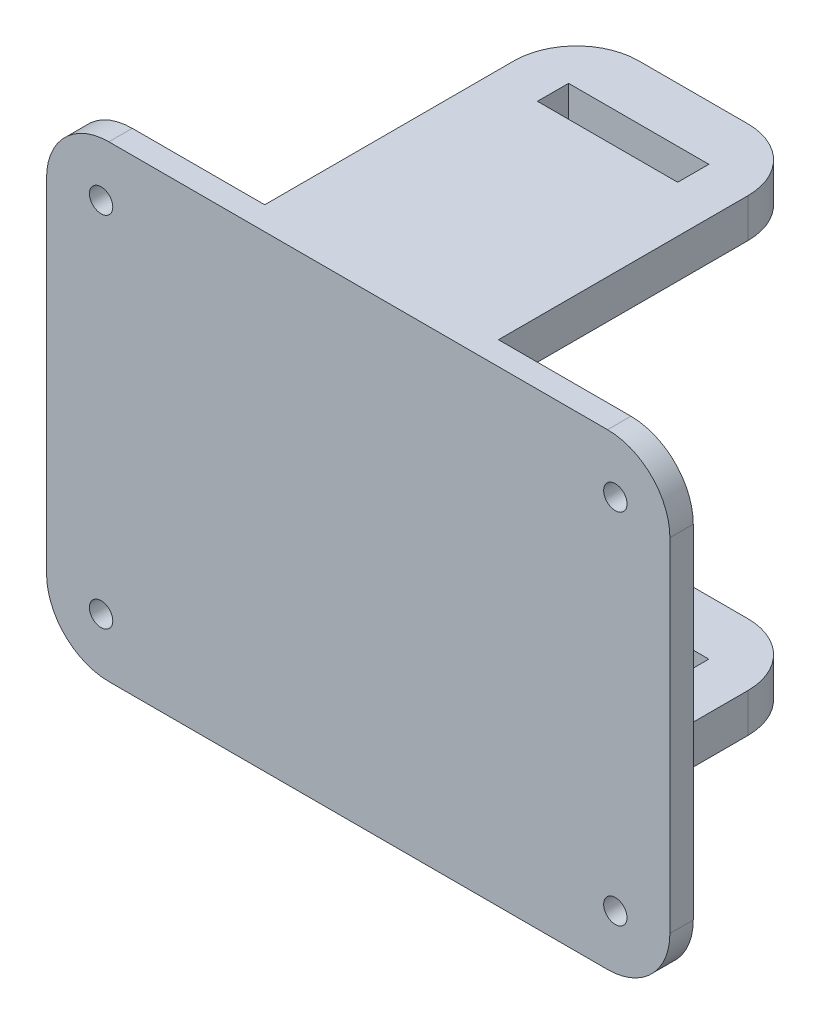
from build123d import *

# Parameters (mm, degrees)
SKETCH1_W           = 30
SKETCH1_H           = 60
BOSS_EXTRUDE1_DEPTH = 5
SKETCH2_W           = 30
SKETCH2_H           = 5
BOSS_EXTRUDE2_DEPTH = 40
BOSS_EXTRUDE3_DEPTH = 7
FILLET1_R           = 2
SKETCH4_W           = 5
SKETCH4_H           = 60
BOSS_EXTRUDE4_DEPTH = 25
SKETCH5_W           = 5
SKETCH5_H           = 60
BOSS_EXTRUDE5_DEPTH = 25
FILLET2_R           = 8
SKETCH6_R           = 1.5
CUT_EXTRUDE1_DEPTH  = 5
FILLET3_R           = 8
CUT_EXTRUDE2_REACH  = 87
SKETCH7_W           = 18
SKETCH7_H           = 4
CUT_EXTRUDE4_DEPTH  = 2


with BuildPart() as part:
    # Sketch1 → Boss-Extrude1 (new body)
    with BuildSketch(Plane.XY):
        Rectangle(SKETCH1_W, SKETCH1_H)
    extrude(amount=-BOSS_EXTRUDE1_DEPTH)

    # Sketch2 → Boss-Extrude2 (add)
    with BuildSketch(Plane(origin=(0, 0, -5), x_dir=(-1, 0, 0), z_dir=(0, 0, -1))):
        with Locations((0, -27.5)):
            Rectangle(SKETCH2_W, SKETCH2_H)
        with Locations((0, 27.5)):
            Rectangle(SKETCH2_W, SKETCH2_H)
    extrude(amount=BOSS_EXTRUDE2_DEPTH)

    # Sketch3 → Boss-Extrude3 (add)
    with BuildSketch(Plane(origin=(0, 0, -5), x_dir=(-1, 0, 0), z_dir=(0, 0, -1))):
        with BuildLine():
            Line((4, -2.5), (-4, -2.5))
            ThreePointArc((-4, -2.5), (-5.414213562, -1.914213562), (-6, -0.5))
            Line((-6, -0.5), (-6, 0.5))
            ThreePointArc((-6, 0.5), (-5.414213562, 1.914213562), (-4, 2.5))
            Line((-4, 2.5), (4, 2.5))
            ThreePointArc((4, 2.5), (5.414213562, 1.914213562), (6, 0.5))
            Line((6, 0.5), (6, -0.5))
            ThreePointArc((6, -0.5), (5.414213562, -1.914213562), (4, -2.5))
        make_face()
    extrude(amount=BOSS_EXTRUDE3_DEPTH)

    # Fillet1
    fillet1_edges = [part.edges().sort_by_distance(p)[0] for p in [
        (0, -25, -5),
        (0, 25, -5),
    ]]
    fillet(fillet1_edges, radius=FILLET1_R)

    # Sketch4 → Boss-Extrude4 (add)
    with BuildSketch(Plane(origin=(15, 0, 0), x_dir=(0, 0, -1), z_dir=(1, 0, 0))):
        with Locations((2.5, 0)):
            Rectangle(SKETCH4_W, SKETCH4_H)
    extrude(amount=BOSS_EXTRUDE4_DEPTH)

    # Sketch5 → Boss-Extrude5 (add)
    with BuildSketch(Plane.ZY.offset(15)):
        with Locations((-2.5, 0)):
            Rectangle(SKETCH5_W, SKETCH5_H)
    extrude(amount=BOSS_EXTRUDE5_DEPTH)

    # Fillet2
    fillet2_edges = [part.edges().sort_by_distance(p)[0] for p in [
        (40, 30, -2.5),
        (40, -30, -2.5),
        (-40, -30, -2.5),
        (-40, 30, -2.5),
    ]]
    fillet(fillet2_edges, radius=FILLET2_R)

    # Sketch6 → Cut-Extrude1 (cut)
    with BuildSketch(Plane(origin=(0, 0, -5), x_dir=(-1, 0, 0), z_dir=(0, 0, -1))):
        with Locations((33, -23)):
            Circle(SKETCH6_R)
        with Locations(Location((-33, -23, 0), (0, 0, 180))):
            Circle(SKETCH6_R)
        with Locations((-33, 23)):
            Circle(SKETCH6_R)
        with Locations(Location((33, 23, 0), (0, 0, 180))):
            Circle(SKETCH6_R)
    extrude(amount=-CUT_EXTRUDE1_DEPTH, mode=Mode.SUBTRACT)

    # Fillet3
    fillet3_edges = [part.edges().sort_by_distance(p)[0] for p in [
        (-15, -27.5, -45),
        (15, -27.5, -45),
        (-15, 27.5, -45),
        (15, 27.5, -45),
    ]]
    fillet(fillet3_edges, radius=FILLET3_R)

    # Cut-Extrude2: up to this face of the body (flat: up to its plane)
    cut_extrude2_end = Plane(part.part.faces().sort_by_distance((0, -30, -19.840780346))[0])
    # Sketch7 → Cut-Extrude2 (cut, up to the picked face)
    with BuildSketch(Plane(origin=(0, 30, 0), x_dir=(1, 0, 0), z_dir=(0, 1, 0)), mode=Mode.PRIVATE) as cut_extrude2_sk1:
        with Locations((0, 36)):
            Rectangle(SKETCH7_W, SKETCH7_H)
    cut_extrude2_tool1 = split(extrude(cut_extrude2_sk1.sketch, amount=-CUT_EXTRUDE2_REACH, mode=Mode.PRIVATE), bisect_by=cut_extrude2_end, keep=Keep.BOTH, mode=Mode.PRIVATE)
    add(cut_extrude2_tool1.solids().sort_by(Axis((0, 30, -36), (0, -1, 0)))[0], mode=Mode.SUBTRACT)

    # Sketch10 → Cut-Extrude4 (cut)
    with BuildSketch(Plane.XY):
        with BuildLine():
            Line((32, 30), (-32, 30))
            ThreePointArc((-32, 30), (-37.656854249, 27.656854249), (-40, 22))
            Line((-40, 22), (-40, -22))
            ThreePointArc((-40, -22), (-37.656854249, -27.656854249), (-32, -30))
            Line((-32, -30), (32, -30))
            ThreePointArc((32, -30), (37.656854249, -27.656854249), (40, -22))
            Line((40, -22), (40, 22))
            ThreePointArc((40, 22), (37.656854249, 27.656854249), (32, 30))
        make_face()
    extrude(amount=-CUT_EXTRUDE4_DEPTH, mode=Mode.SUBTRACT)


solid = part.part
